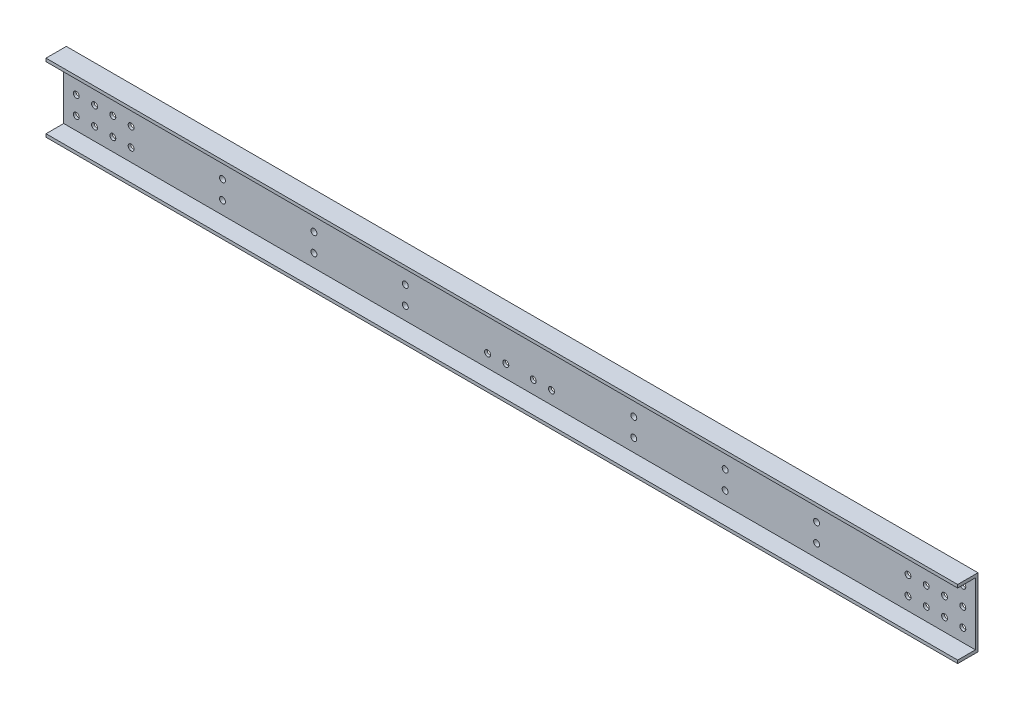
from build123d import *

# Parameters (mm, degrees)
SKETCH_1_W          = 3990
SKETCH_1_H          = 300
SKETCH_1_R          = 13
EXTRUDE_706_DEPTH   = 11.5
SKETCH_2_W          = 3990
SKETCH_2_H          = 13.5
EXTRUDE_1_DEPTH     = 77.5
SKETCH_3_W          = 70
SKETCH_3_H          = 230
EXTRUDE_2_DEPTH     = 16
SKETCH_4_R          = 13
CUT_EXTRUDE_1_DEPTH = 2004.38463606


with BuildPart() as part:
    # 草图1 → Extrude 706 (new body)
    with BuildSketch(Plane.XY):
        Rectangle(SKETCH_1_W, SKETCH_1_H)
        with Locations((1940, 0)):
            Circle(SKETCH_1_R, mode=Mode.SUBTRACT)
        with Locations((1860, 0)):
            Circle(SKETCH_1_R, mode=Mode.SUBTRACT)
        with Locations((1780, 0)):
            Circle(SKETCH_1_R, mode=Mode.SUBTRACT)
        with Locations((1700, 0)):
            Circle(SKETCH_1_R, mode=Mode.SUBTRACT)
        with Locations((1700, 80)):
            Circle(SKETCH_1_R, mode=Mode.SUBTRACT)
        with Locations((1780, 80)):
            Circle(SKETCH_1_R, mode=Mode.SUBTRACT)
        with Locations((1860, 80)):
            Circle(SKETCH_1_R, mode=Mode.SUBTRACT)
        with Locations((1940, 80)):
            Circle(SKETCH_1_R, mode=Mode.SUBTRACT)
        with Locations(Location((1940, -80, 0), (0, 0, 180))):
            Circle(SKETCH_1_R, mode=Mode.SUBTRACT)
        with Locations(Location((1860, -80, 0), (0, 0, 180))):
            Circle(SKETCH_1_R, mode=Mode.SUBTRACT)
        with Locations(Location((1780, -80, 0), (0, 0, 180))):
            Circle(SKETCH_1_R, mode=Mode.SUBTRACT)
        with Locations(Location((1700, -80, 0), (0, 0, 180))):
            Circle(SKETCH_1_R, mode=Mode.SUBTRACT)
        with Locations((-1700, -80)):
            Circle(SKETCH_1_R, mode=Mode.SUBTRACT)
        with Locations((-1780, -80)):
            Circle(SKETCH_1_R, mode=Mode.SUBTRACT)
        with Locations((-1860, -80)):
            Circle(SKETCH_1_R, mode=Mode.SUBTRACT)
        with Locations((-1940, -80)):
            Circle(SKETCH_1_R, mode=Mode.SUBTRACT)
        with Locations(Location((-1940, 80, 0), (0, 0, 180))):
            Circle(SKETCH_1_R, mode=Mode.SUBTRACT)
        with Locations(Location((-1860, 80, 0), (0, 0, 180))):
            Circle(SKETCH_1_R, mode=Mode.SUBTRACT)
        with Locations(Location((-1780, 80, 0), (0, 0, 180))):
            Circle(SKETCH_1_R, mode=Mode.SUBTRACT)
        with Locations(Location((-1700, 80, 0), (0, 0, 180))):
            Circle(SKETCH_1_R, mode=Mode.SUBTRACT)
        with Locations(Location((-1700, 0, 0), (0, 0, 180))):
            Circle(SKETCH_1_R, mode=Mode.SUBTRACT)
        with Locations(Location((-1780, 0, 0), (0, 0, 180))):
            Circle(SKETCH_1_R, mode=Mode.SUBTRACT)
        with Locations(Location((-1860, 0, 0), (0, 0, 180))):
            Circle(SKETCH_1_R, mode=Mode.SUBTRACT)
        with Locations(Location((-1940, 0, 0), (0, 0, 180))):
            Circle(SKETCH_1_R, mode=Mode.SUBTRACT)
        with Locations((60, 80)):
            Circle(SKETCH_1_R, mode=Mode.SUBTRACT)
        with Locations((140, 80)):
            Circle(SKETCH_1_R, mode=Mode.SUBTRACT)
        with Locations(Location((140, -80, 0), (0, 0, 180))):
            Circle(SKETCH_1_R, mode=Mode.SUBTRACT)
        with Locations(Location((60, -80, 0), (0, 0, 180))):
            Circle(SKETCH_1_R, mode=Mode.SUBTRACT)
        with Locations((-60, -80)):
            Circle(SKETCH_1_R, mode=Mode.SUBTRACT)
        with Locations((-140, -80)):
            Circle(SKETCH_1_R, mode=Mode.SUBTRACT)
        with Locations(Location((-140, 80, 0), (0, 0, 180))):
            Circle(SKETCH_1_R, mode=Mode.SUBTRACT)
        with Locations(Location((-60, 80, 0), (0, 0, 180))):
            Circle(SKETCH_1_R, mode=Mode.SUBTRACT)
    extrude(amount=EXTRUDE_706_DEPTH)

    # 草图2 → 凸台-拉伸1 (add)
    with BuildSketch(Plane.XY.offset(11.5)):
        with Locations((0, 143.25)):
            Rectangle(SKETCH_2_W, SKETCH_2_H)
        with Locations((0, -143.25)):
            Rectangle(SKETCH_2_W, SKETCH_2_H)
    extrude(amount=EXTRUDE_1_DEPTH)

    # 草图3 → 凸台-拉伸2 (add)
    with BuildSketch(Plane(origin=(0, 0, 0), x_dir=(-1, 0, 0), z_dir=(0, 0, -1))):
        with Locations((-1300, 0)):
            Rectangle(SKETCH_3_W, SKETCH_3_H)
        with Locations((-900, 0)):
            Rectangle(SKETCH_3_W, SKETCH_3_H)
        with Locations((-500, 0)):
            Rectangle(SKETCH_3_W, SKETCH_3_H)
        with Locations((500, 0)):
            Rectangle(SKETCH_3_W, SKETCH_3_H)
        with Locations((900, 0)):
            Rectangle(SKETCH_3_W, SKETCH_3_H)
        with Locations((1300, 0)):
            Rectangle(SKETCH_3_W, SKETCH_3_H)
    extrude(amount=EXTRUDE_2_DEPTH)

    # 草图4 → 切除-拉伸1 (cut, through all)
    with BuildSketch(Plane(origin=(0, 0, -16), x_dir=(-1, 0, 0), z_dir=(0, 0, -1))):
        with Locations((-1300, 0)):
            Circle(SKETCH_4_R)
        with Locations((-1300, 80)):
            Circle(SKETCH_4_R)
        with Locations((-900, 80)):
            Circle(SKETCH_4_R)
        with Locations((-900, 0)):
            Circle(SKETCH_4_R)
        with Locations((-500, 80)):
            Circle(SKETCH_4_R)
        with Locations((-500, 0)):
            Circle(SKETCH_4_R)
        with Locations(Location((-500, -80, 0), (0, 0, 180))):
            Circle(SKETCH_4_R)
        with Locations(Location((-900, -80, 0), (0, 0, 180))):
            Circle(SKETCH_4_R)
        with Locations(Location((-1300, -80, 0), (0, 0, 180))):
            Circle(SKETCH_4_R)
        with Locations((1300, -80)):
            Circle(SKETCH_4_R)
        with Locations((900, -80)):
            Circle(SKETCH_4_R)
        with Locations((500, -80)):
            Circle(SKETCH_4_R)
        with Locations(Location((500, 0, 0), (0, 0, 180))):
            Circle(SKETCH_4_R)
        with Locations(Location((500, 80, 0), (0, 0, 180))):
            Circle(SKETCH_4_R)
        with Locations(Location((900, 0, 0), (0, 0, 180))):
            Circle(SKETCH_4_R)
        with Locations(Location((900, 80, 0), (0, 0, 180))):
            Circle(SKETCH_4_R)
        with Locations(Location((1300, 80, 0), (0, 0, 180))):
            Circle(SKETCH_4_R)
        with Locations(Location((1300, 0, 0), (0, 0, 180))):
            Circle(SKETCH_4_R)
    extrude(amount=-CUT_EXTRUDE_1_DEPTH, mode=Mode.SUBTRACT)


solid = part.part
